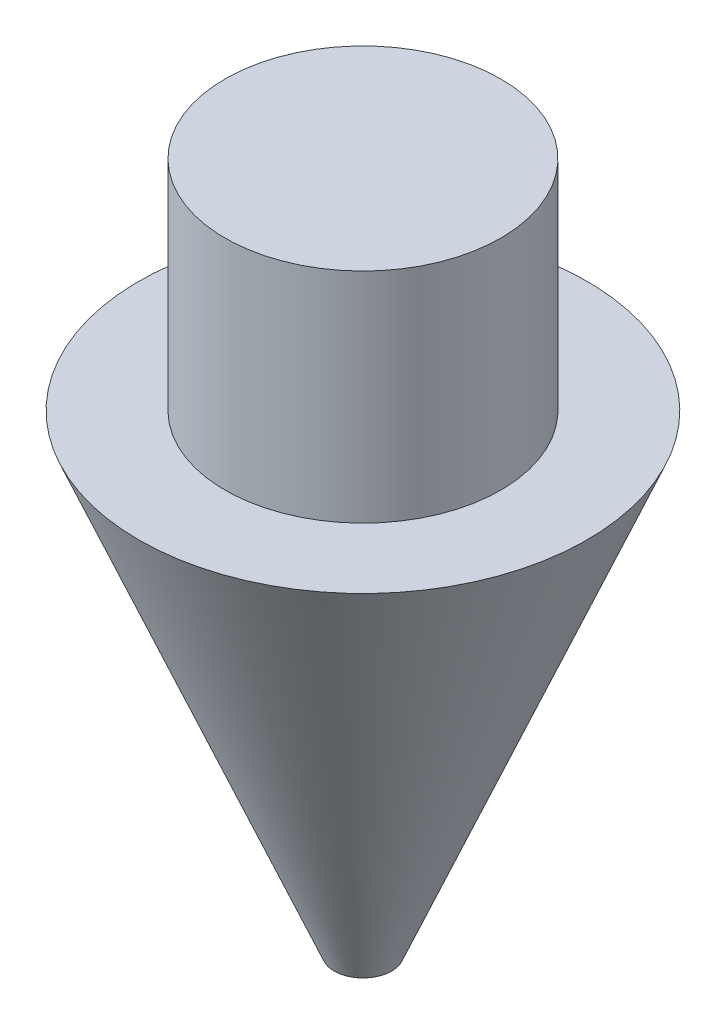
from build123d import *


with BuildPart() as part:
    # Skizze1 → Rotation3 (revolve)
    with BuildSketch(Plane.XY, mode=Mode.PRIVATE) as rotation3_sk:
        Polygon((0, 0), (2.4, 0), (2.4, -3.8), (3.9, -3.8), (0.5, -12), (0, -12), align=None)
    revolve(rotation3_sk.sketch.rotate(Axis((0, -12, 0), (0, 1, 0)), 90), axis=Axis((0, -12, 0), (0, 1, 0)))


solid = part.part
